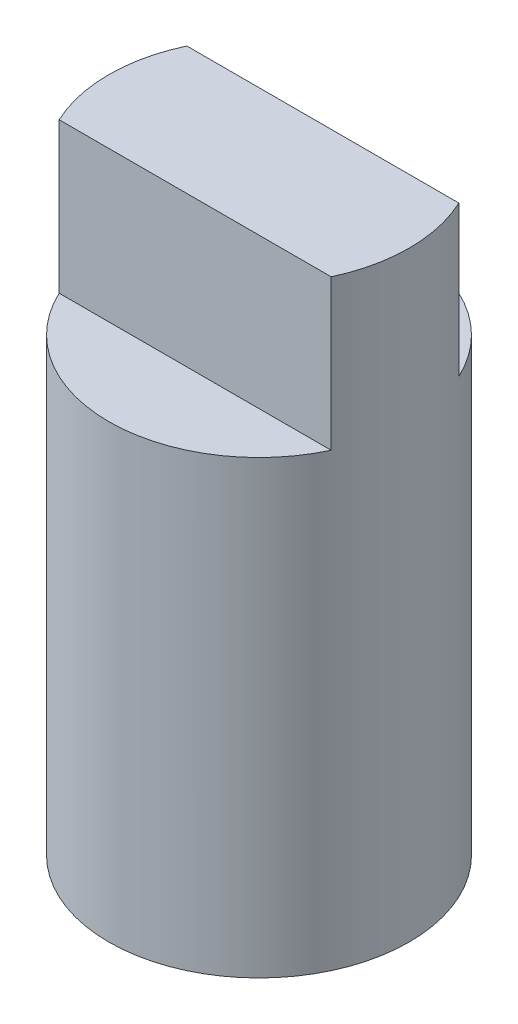
from build123d import *

# Parameters (mm, degrees)
SKETCH1_R           = 25.4
BOSS_EXTRUDE1_DEPTH = 101.6
CUT_EXTRUDE1_REACH  = 118.397
SKETCH2_W           = 14.605
SKETCH2_H           = 25.4


with BuildPart() as part:
    # Sketch1 → Boss-Extrude1 (new body)
    with BuildSketch(Plane(origin=(0, 0, 0), x_dir=(1, 0, 0), z_dir=(0, 1, 0))):
        with Locations(Location((0, 0, 0), (0, 0, 270))):
            Circle(SKETCH1_R)
    extrude(amount=BOSS_EXTRUDE1_DEPTH)

    # Sketch2 → Cut-Extrude1 (cut, up to next)
    with BuildSketch(Plane(origin=(25.4, 0, 0), x_dir=(0, 0, -1), z_dir=(1, 0, 0)), mode=Mode.PRIVATE) as cut_extrude1_sk1:
        with Locations((-18.0975, 88.9)):
            Rectangle(SKETCH2_W, SKETCH2_H)
    cut_extrude1_tool1 = extrude(cut_extrude1_sk1.sketch, amount=-CUT_EXTRUDE1_REACH, mode=Mode.PRIVATE) & part.part
    # Sketch2 → Cut-Extrude1 (cut, up to next)
    with BuildSketch(Plane(origin=(25.4, 0, 0), x_dir=(0, 0, -1), z_dir=(1, 0, 0)), mode=Mode.PRIVATE) as cut_extrude1_sk2:
        with Locations((18.0975, 88.9)):
            Rectangle(SKETCH2_W, SKETCH2_H)
    cut_extrude1_tool2 = extrude(cut_extrude1_sk2.sketch, amount=-CUT_EXTRUDE1_REACH, mode=Mode.PRIVATE) & part.part
    add(cut_extrude1_tool1.solids().sort_by_distance((25.4, 88.9, 18.0975))[0], mode=Mode.SUBTRACT)
    add(cut_extrude1_tool2.solids().sort_by_distance((25.4, 88.9, -18.0975))[0], mode=Mode.SUBTRACT)


solid = part.part
